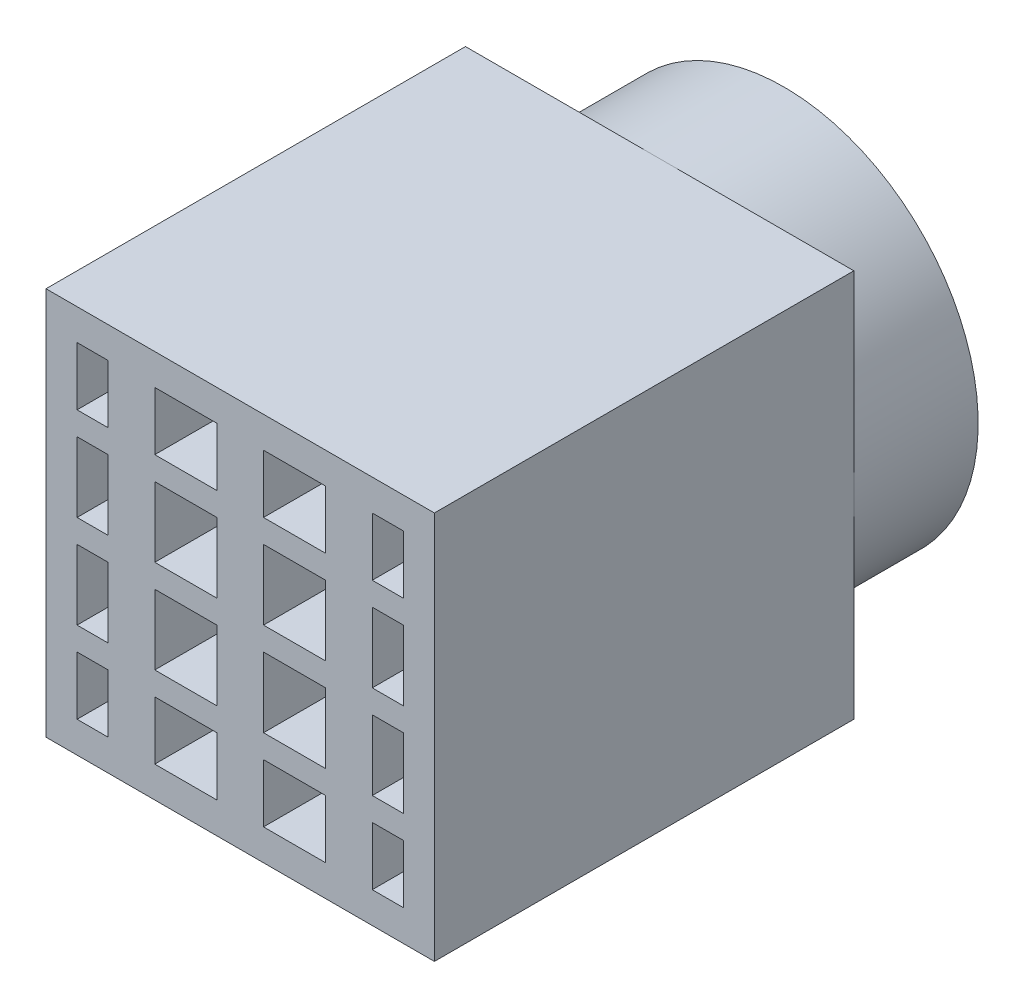
from build123d import *

# Parameters (mm, degrees)
SKETCH_8_W       = 25
SKETCH_8_H       = 25
SKETCH_8_W_2     = 4
SKETCH_8_H_2     = 21
SKETCH_8_W_3     = 2
EXTRUDE_7_DEPTH  = 25
SKETCH_9_W       = 25
SKETCH_9_H       = 25
EXTRUDE_8_DEPTH  = 2
SKETCH_14_W      = 25
SKETCH_14_H      = 1.5
EXTRUDE_11_DEPTH = 25
SKETCH_16_R      = 12.5
SKETCH_16_R_2    = 10
EXTRUDE_14_DEPTH = 6
SKETCH_17_R      = 12.5
EXTRUDE_15_DEPTH = 2


with BuildPart() as part:
    # 草图8 → 凸台-拉伸7 (new body)
    with BuildSketch(Plane.XY):
        Rectangle(SKETCH_8_W, SKETCH_8_H)
        with Locations((3.5, 0)):
            Rectangle(SKETCH_8_W_2, SKETCH_8_H_2, mode=Mode.SUBTRACT)
        with Locations((-3.5, 0)):
            Rectangle(SKETCH_8_W_2, SKETCH_8_H_2, mode=Mode.SUBTRACT)
        with Locations((-9.5, 0)):
            Rectangle(SKETCH_8_W_3, SKETCH_8_H_2, mode=Mode.SUBTRACT)
        with Locations((9.5, 0)):
            Rectangle(SKETCH_8_W_3, SKETCH_8_H_2, mode=Mode.SUBTRACT)
    extrude(amount=EXTRUDE_7_DEPTH)

    # 草图9 → 凸台-拉伸8 (add)
    with BuildSketch(Plane(origin=(0, 0, 0), x_dir=(-1, 0, 0), z_dir=(0, 0, -1))):
        Rectangle(SKETCH_9_W, SKETCH_9_H)
    extrude(amount=EXTRUDE_8_DEPTH)

    # 草图14 → 凸台-拉伸11 (add)
    with BuildSketch(Plane.XY.offset(25)):
        Rectangle(SKETCH_14_W, SKETCH_14_H)
        with Locations((0, 6)):
            Rectangle(SKETCH_14_W, SKETCH_14_H)
        with Locations((0, -6)):
            Rectangle(SKETCH_14_W, SKETCH_14_H)
    extrude(amount=-EXTRUDE_11_DEPTH)

    # 草图16 → 凸台-拉伸14 (add)
    with BuildSketch(Plane(origin=(0, 0, -2), x_dir=(-1, 0, 0), z_dir=(0, 0, -1))):
        Circle(SKETCH_16_R)
        Circle(SKETCH_16_R_2, mode=Mode.SUBTRACT)
    extrude(amount=EXTRUDE_14_DEPTH)

    # 草图17 → 凸台-拉伸15 (add)
    with BuildSketch(Plane(origin=(0, 0, -8), x_dir=(-1, 0, 0), z_dir=(0, 0, -1))):
        Circle(SKETCH_17_R)
    extrude(amount=EXTRUDE_15_DEPTH)


solid = part.part
